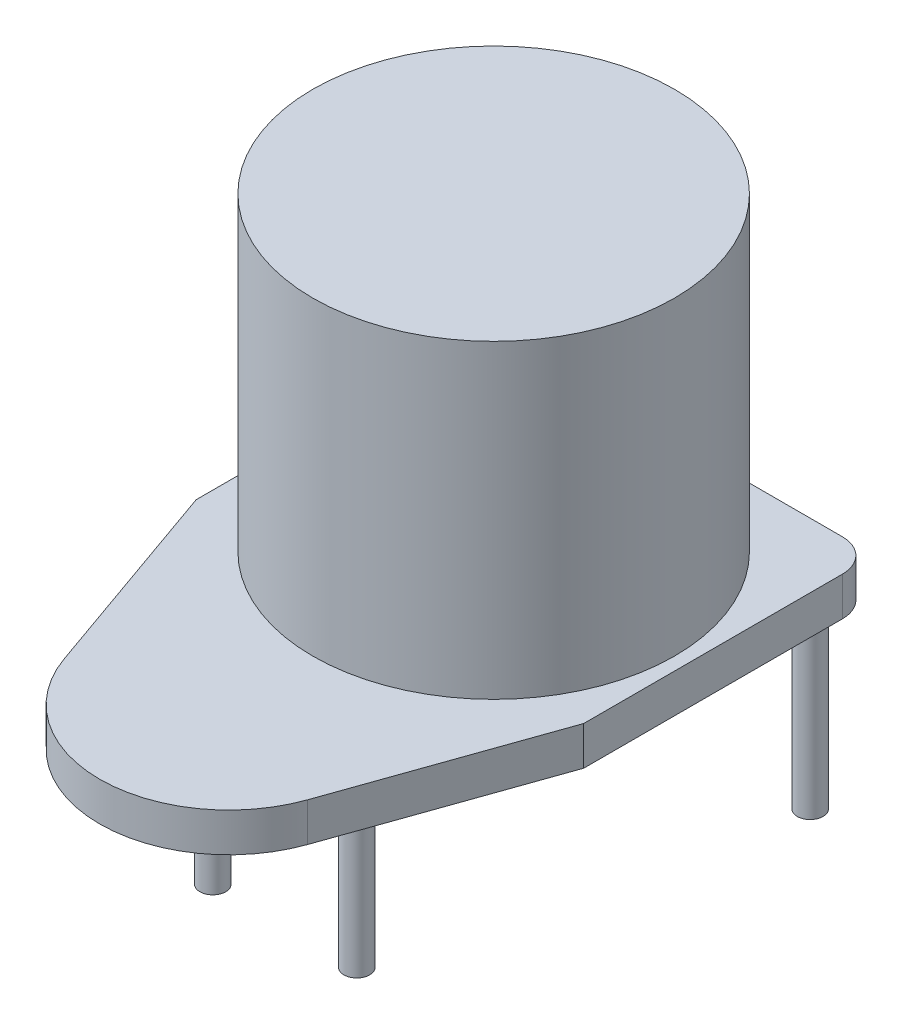
from build123d import *

# Parameters (mm, degrees)
BOSS_EXTRUDE1_START = 38.1
BOSS_EXTRUDE1_DEPTH = 7.62
FILLET1_R           = 6.35
SKETCH3_R           = 2.54
BOSS_EXTRUDE2_DEPTH = 43.18
SKETCH4_R           = 35.56
BOSS_EXTRUDE3_DEPTH = 60.96


with BuildPart() as part:
    # Sketch1 → Boss-Extrude1 (new body)
    with BuildSketch(Plane(origin=(0, 0, 0), x_dir=(1, 0, 0), z_dir=(0, 1, 0)).offset(BOSS_EXTRUDE1_START)):
        with BuildLine():
            Line((-38.1, -0.419392835), (-23.955144175, -40.544743901))
            ThreePointArc((-23.955144175, -40.544743901), (0, -57.500155839), (23.955144175, -40.544743901))
            Line((23.955144175, -40.544743901), (38.1, -0.419392835))
            Line((38.1, -0.419392835), (38.1, 56.799844161))
            Line((38.1, 56.799844161), (-38.1, 56.799844161))
            Line((-38.1, 56.799844161), (-38.1, -0.419392835))
        make_face()
    extrude(amount=BOSS_EXTRUDE1_DEPTH)

    # Fillet1
    fillet1_edges = [part.edges().sort_by_distance(p)[0] for p in [
        (-38.1, 41.91, -56.799844161),
        (38.1, 41.91, -56.799844161),
    ]]
    fillet(fillet1_edges, radius=FILLET1_R)

    # Sketch3 → Boss-Extrude2 (add)
    with BuildSketch(Plane(origin=(0, 45.72, 0), x_dir=(1, 0, 0), z_dir=(0, 1, 0))):
        with Locations(Location((-31.75, 50.449844161, 0), (0, 0, 270))):
            Circle(SKETCH3_R)
        with Locations(Location((31.75, 50.449844161, 0), (0, 0, 270))):
            Circle(SKETCH3_R)
        with Locations(Location((-14.154646808, -21.090423745, 0), (0, 0, 270))):
            Circle(SKETCH3_R)
        with Locations(Location((14.154646808, -21.090423745, 0), (0, 0, 270))):
            Circle(SKETCH3_R)
    extrude(amount=-BOSS_EXTRUDE2_DEPTH)

    # Sketch4 → Boss-Extrude3 (add)
    with BuildSketch(Plane(origin=(0, 45.72, 0), x_dir=(1, 0, 0), z_dir=(0, 1, 0))):
        with Locations(Location((0, 19.969844161, 0), (0, 0, 90))):
            Circle(SKETCH4_R)
    extrude(amount=BOSS_EXTRUDE3_DEPTH)


solid = part.part
